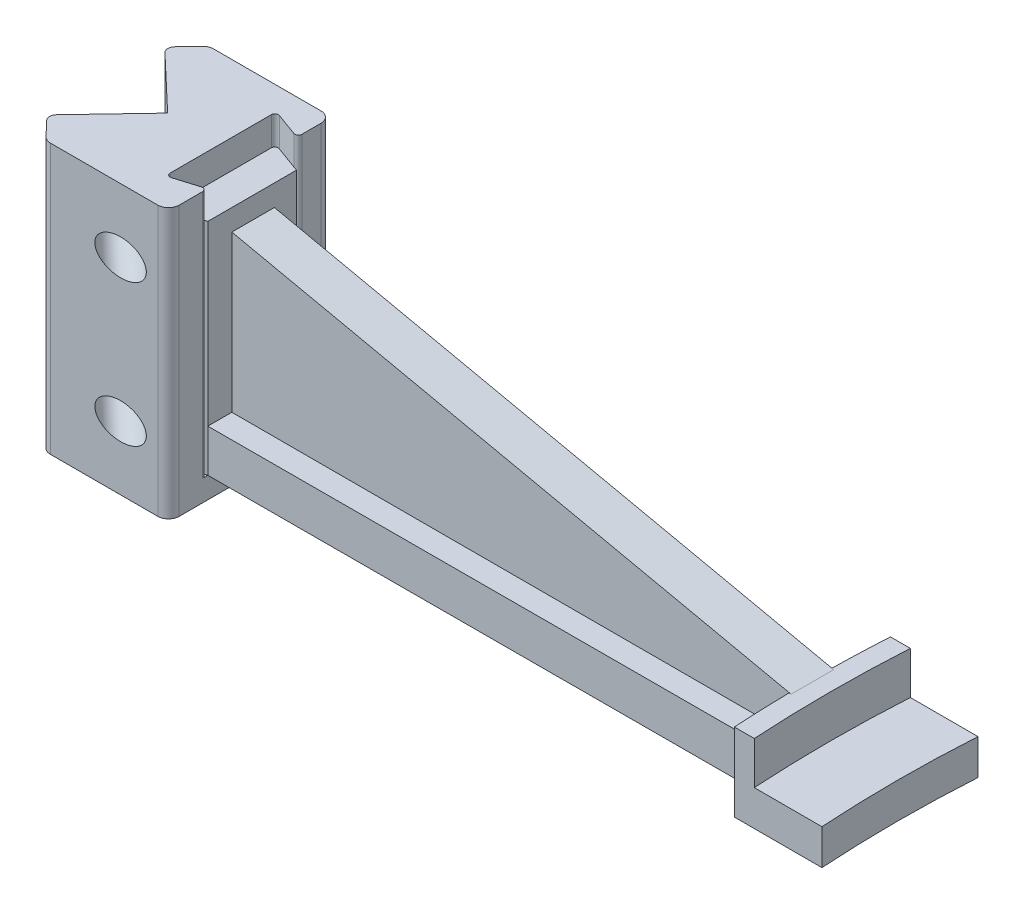
from build123d import *

# Parameters (mm, degrees)
BOSS_EXTRUDE2_DEPTH       = 12
BOSS_EXTRUDE3_START       = -2
BOSS_EXTRUDE3_DEPTH       = 10
BOSS_EXTRUDE4_START       = 10
BOSS_EXTRUDE4_DEPTH       = 22
BOSS_EXTRUDE5_START       = -12
BOSS_EXTRUDE5_DEPTH       = 6
BOSS_EXTRUDE6_START       = -12
BOSS_EXTRUDE6_DEPTH       = 70
BOSS_EXTRUDE7_DEPTH       = 50
BOSS_EXTRUDE17_DEPTH      = 6
BOSS_EXTRUDE17_DEPTH_BACK = 6
CUT_EXTRUDE1_START        = -8
SKETCH5_R                 = 5
CUT_EXTRUDE1_DEPTH        = 168.948348154
SKETCH5_3_R               = 2.75
CUT_EXTRUDE2_DEPTH        = 176.948348154
FILLET1_R                 = 1
FILLET2_R                 = 1
FILLET3_R                 = 3
FILLET4_R                 = 2


with BuildPart() as part:
    # Sketch2 → Boss-Extrude2 (new body)
    with BuildSketch(Plane(origin=(0, 0, 0), x_dir=(1, 0, 0), z_dir=(0, 1, 0))):
        with BuildLine():
            Line((0.21086679, 12.5), (-157.02456554, 12.229205734))
            Line((-157.02456554, 12.229205734), (-157.02456554, -12.770794266))
            Line((-157.02456554, -12.770794266), (0.21086679, -12.5))
            ThreePointArc((0.21086679, -12.5), (0, 0), (0.21086679, 12.5))
        make_face()
        Polygon((-157.02456554, 12.229205734), (-166.02456554, 12.213705739), (-166.02456554, -12.786294261), (-157.02456554, -12.770794266), align=None)
        Polygon((-157.02456554, -12.770794266), (-166.02456554, -12.786294261), (-166.02456554, -15.504937842), align=None)
        Polygon((-166.02456554, 15.504937842), (-166.02456554, 12.213705739), (-157.02456554, 12.229205734), align=None)
        with BuildLine():
            ThreePointArc((0.653571446, 22), (0.401744327, 17.25142014), (0.21086679, 12.5))
            ThreePointArc((0.21086679, 12.5), (0, 0), (0.21086679, -12.5))
            ThreePointArc((0.21086679, -12.5), (0.401744327, -17.25142014), (0.653571446, -22))
            Line((0.653571446, -22), (6.263616969, -22))
            ThreePointArc((6.263616969, -22), (5.6, 0), (6.263616969, 22))
            Line((6.263616969, 22), (0.653571446, 22))
        make_face()
    extrude(amount=-BOSS_EXTRUDE2_DEPTH)

    # Sketch2<5> → Boss-Extrude3 (add)
    with BuildSketch(Plane(origin=(0, 0, 0), x_dir=(1, 0, 0), z_dir=(0, 1, 0)).offset(BOSS_EXTRUDE3_START)):
        with BuildLine():
            Line((25.340211435, 22), (6.263616969, 22))
            ThreePointArc((6.263616969, 22), (5.6, 0), (6.263616969, -22))
            Line((6.263616969, -22), (25.340211435, -22))
            ThreePointArc((25.340211435, -22), (24.64, 0), (25.340211435, 22))
        make_face()
    extrude(amount=-BOSS_EXTRUDE3_DEPTH)

    # Sketch2<6> → Boss-Extrude4 (add)
    with BuildSketch(Plane(origin=(0, 0, 0), x_dir=(1, 0, 0), z_dir=(0, 1, 0)).offset(BOSS_EXTRUDE4_START)):
        with BuildLine():
            ThreePointArc((0.653571446, 22), (0.401744327, 17.25142014), (0.21086679, 12.5))
            ThreePointArc((0.21086679, 12.5), (0, 0), (0.21086679, -12.5))
            ThreePointArc((0.21086679, -12.5), (0.401744327, -17.25142014), (0.653571446, -22))
            Line((0.653571446, -22), (6.263616969, -22))
            ThreePointArc((6.263616969, -22), (5.6, 0), (6.263616969, 22))
            Line((6.263616969, 22), (0.653571446, 22))
        make_face()
    extrude(amount=-BOSS_EXTRUDE4_DEPTH)

    # Sketch2<9> → Boss-Extrude7 (add)
    with BuildSketch(Plane(origin=(0, 0, 0), x_dir=(1, 0, 0), z_dir=(0, 1, 0))):
        Polygon((-157.02456554, 12.229205734), (-166.02456554, 12.213705739), (-166.02456554, -12.786294261), (-157.02456554, -12.770794266), align=None)
        Polygon((-166.02456554, 15.504937842), (-166.02456554, 12.213705739), (-157.02456554, 12.229205734), align=None)
        Polygon((-157.02456554, -12.770794266), (-166.02456554, -12.786294261), (-166.02456554, -15.504937842), align=None)
    extrude(amount=BOSS_EXTRUDE7_DEPTH)

    # Sketch4 → Boss-Extrude17 (add, two sides: drawn at the far end of the back side and taken through both)
    with BuildSketch(Plane.XY.offset(-BOSS_EXTRUDE17_DEPTH_BACK)):
        Polygon((0.653571446, 10), (-157.02456554, 44), (-157.02456554, 0), (0.653571446, 0), align=None)
    extrude(amount=BOSS_EXTRUDE17_DEPTH + BOSS_EXTRUDE17_DEPTH_BACK)

    # Fillet2
    fillet2_edges = [part.edges().sort_by_distance(p)[0] for p in [
        (-166.02456554, 19, 15.504937842),
        (-166.02456554, 19, -15.504937842),
    ]]
    fillet(fillet2_edges, radius=FILLET2_R)


with BuildPart() as body_2:
    # Sketch2<7> → Boss-Extrude5 (new body)
    with BuildSketch(Plane(origin=(0, 0, 0), x_dir=(1, 0, 0), z_dir=(0, 1, 0)).offset(BOSS_EXTRUDE5_START)):
        Polygon((-157.02456554, -23.850407561), (-157.02456554, 22.149592439), (-191.610767905, 22.149592439), (-197.696610314, 15.743442535), (-181.12456554, 0), (-197.696610314, -17.444257657), (-191.610767905, -23.850407561), align=None)
    extrude(amount=-BOSS_EXTRUDE5_DEPTH)

    # Sketch2<8> → Boss-Extrude6 (add)
    with BuildSketch(Plane(origin=(0, 0, 0), x_dir=(1, 0, 0), z_dir=(0, 1, 0)).offset(BOSS_EXTRUDE6_START)):
        Polygon((-197.696610314, 15.743442535), (-181.12456554, 0), (-197.696610314, -17.444257657), (-191.610767905, -23.850407561), (-157.02456554, -23.850407561), (-157.02456554, -12.875306975), (-166.12456554, -15.639829924), (-166.12456554, 15.647752643), (-157.02456554, 12.335623511), (-157.02456554, 22.149592439), (-191.610767905, 22.149592439), align=None)
    extrude(amount=BOSS_EXTRUDE6_DEPTH)

    # Sketch5 → Cut-Extrude1 (cut, through all)
    with BuildSketch(Plane(origin=(-95.203451007, 0, -90.443278456), x_dir=(-0.6887494619146907, 0, 0.724999433594416), z_dir=(-0.724999433594416, 0, -0.6887494619146907)).offset(CUT_EXTRUDE1_START)):
        with Locations((134.749447055, 40)):
            Circle(SKETCH5_R)
        with Locations((134.749447055, 0)):
            Circle(SKETCH5_R)
    cut_extrude1 = extrude(amount=-CUT_EXTRUDE1_DEPTH, mode=Mode.SUBTRACT)

    # Sketch5<3> → Cut-Extrude2 (cut, symmetric)
    with BuildSketch(Plane(origin=(-95.203451007, 0, -90.443278456), x_dir=(-0.6887494619146907, 0, 0.724999433594416), z_dir=(-0.724999433594416, 0, -0.6887494619146907))):
        with Locations((134.749447055, 40)):
            Circle(SKETCH5_3_R)
        with Locations((134.749447055, 0)):
            Circle(SKETCH5_3_R)
    cut_extrude2 = extrude(amount=CUT_EXTRUDE2_DEPTH, both=True, mode=Mode.SUBTRACT)

    # Mirror1: Cut-Extrude1, Cut-Extrude2 across plane
    add(cut_extrude1.mirror(Plane.XY), mode=Mode.SUBTRACT)
    add(cut_extrude2.mirror(Plane.XY), mode=Mode.SUBTRACT)

    # Fillet1
    fillet1_edges = [body_2.edges().sort_by_distance(p)[0] for p in [
        (-157.02456554, 23, 12.875306975),
        (-166.12456554, 23, 15.639829924),
        (-166.12456554, 23, -15.647752643),
        (-157.02456554, 23, -12.335623511),
    ]]
    fillet(fillet1_edges, radius=FILLET1_R)

    # Fillet3
    fillet3_edges = [body_2.edges().sort_by_distance(p)[0] for p in [
        (-157.02456554, 20, 23.850407561),
        (-157.02456554, 20, -22.149592439),
        (-191.610767905, 20, -22.149592439),
        (-191.610767905, 20, 23.850407561),
    ]]
    fillet(fillet3_edges, radius=FILLET3_R)

    # Fillet4
    fillet4_edges = [body_2.edges().sort_by_distance(p)[0] for p in [
        (-197.696610314, 20, -15.743442535),
        (-197.696610314, 20, 17.444257657),
    ]]
    fillet(fillet4_edges, radius=FILLET4_R)


solid = Compound([part.part, body_2.part])
